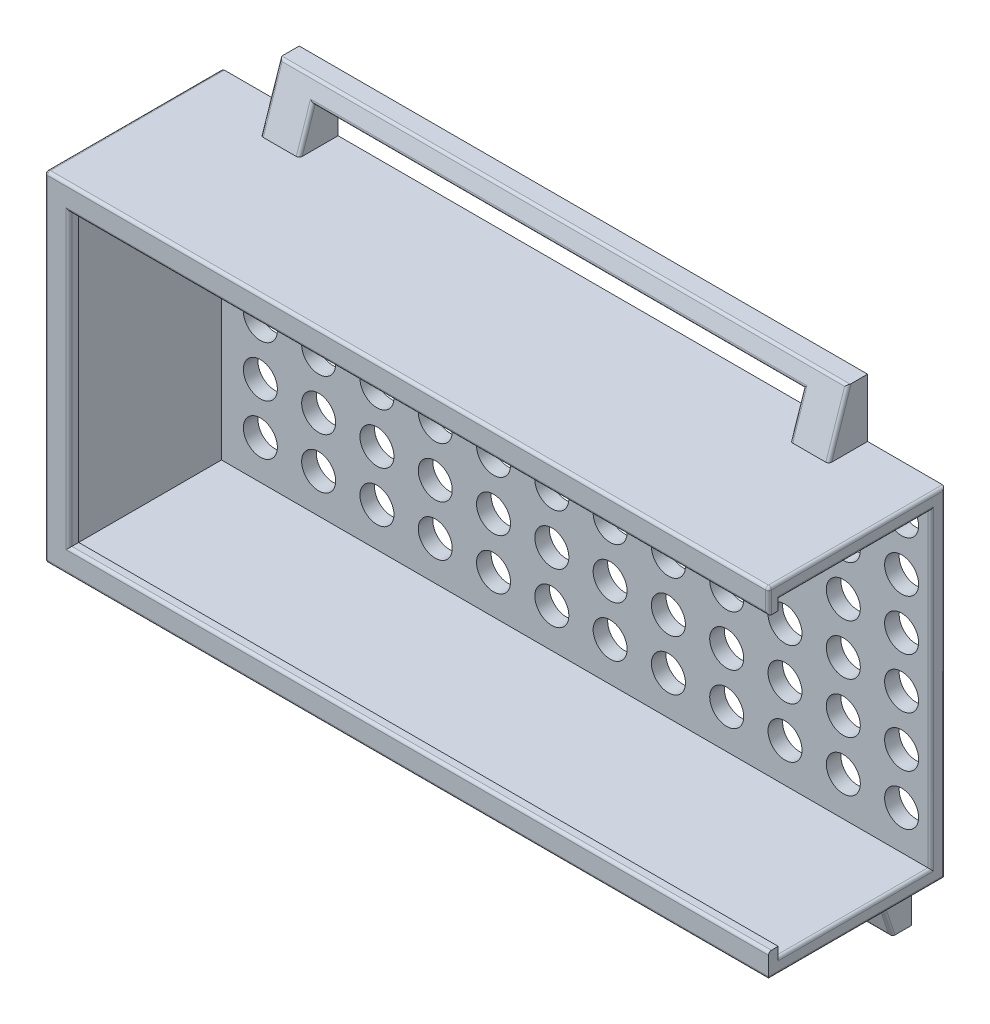
from build123d import *

# Parameters (mm, degrees)
SKETCH_1_W          = 74.5
SKETCH_1_H          = 34.9
SKETCH_1_W_2        = 71.5
SKETCH_1_H_2        = 31.9
EXTRUDE_1_DEPTH     = 18.2
SKETCH_2_W          = 71.5
SKETCH_2_H          = 31.9
EXTRUDE_2_DEPTH     = 1.5
SKETCH_3_W          = 16.7
SKETCH_3_H          = 31.9
CUT_EXTRUDE_1_DEPTH = 83.315247676
EXTRUDE_3_DEPTH     = 1
SKETCH_5_W          = 4
SKETCH_5_H          = 4
EXTRUDE_5_DEPTH     = 6
EXTRUDE_6_REACH     = 78.091
SKETCH_15_W         = 4
SKETCH_15_H         = 2
CUT_EXTRUDE_2_DEPTH = 80.409382317
SKETCH_17_W         = 4
SKETCH_17_H         = 4
EXTRUDE_7_DEPTH     = 6
EXTRUDE_8_REACH     = 81.829
SKETCH_18_W         = 4
SKETCH_18_H         = 2
CUT_EXTRUDE_3_DEPTH = 84.214181484
FILLET_1_R          = 0.3
SKETCH_20_R         = 1.75
CUT_EXTRUDE_4_DEPTH = 85.618260441


with BuildPart() as part:
    # 草图1 → 凸台-拉伸1 (new body)
    with BuildSketch(Plane.XY):
        with Locations((35.75, 15.95)):
            Rectangle(SKETCH_1_W, SKETCH_1_H)
        with Locations((35.75, 15.95)):
            Rectangle(SKETCH_1_W_2, SKETCH_1_H_2, mode=Mode.SUBTRACT)
    extrude(amount=EXTRUDE_1_DEPTH)

    # 草图2 → 凸台-拉伸2 (add)
    with BuildSketch(Plane(origin=(0, 0, 0), x_dir=(-1, 0, 0), z_dir=(0, 0, -1))):
        with Locations((-35.75, 15.95)):
            Rectangle(SKETCH_2_W, SKETCH_2_H)
    extrude(amount=-EXTRUDE_2_DEPTH)

    # 草图3 → 切除-拉伸1 (cut, through all)
    with BuildSketch(Plane.ZY.offset(-71.5)):
        with Locations((9.85, 15.95)):
            Rectangle(SKETCH_3_W, SKETCH_3_H)
    extrude(amount=-CUT_EXTRUDE_1_DEPTH, mode=Mode.SUBTRACT)

    # 草图4 → 凸台-拉伸3 (add)
    with BuildSketch(Plane.XY.offset(18.2)):
        Polygon((1, 1), (73, 1), (73, 0), (0, 0), (0, 31.9), (73, 31.9), (73, 30.9), (1, 30.9), align=None)
    extrude(amount=-EXTRUDE_3_DEPTH)

    # 草图5 → 凸台-拉伸5 (add)
    with BuildSketch(Plane(origin=(0, 33.4, 0), x_dir=(1, 0, 0), z_dir=(0, 1, 0))):
        with Locations((8.5, -2)):
            Rectangle(SKETCH_5_W, SKETCH_5_H)
        with Locations((63, -2)):
            Rectangle(SKETCH_5_W, SKETCH_5_H)
    extrude(amount=EXTRUDE_5_DEPTH)

    # 草图15 → 凸台-拉伸6 (add, up to next)
    with BuildSketch(Plane.ZY.offset(-61), mode=Mode.PRIVATE) as extrude_6_sk1:
        with Locations((2, 38.4)):
            Rectangle(SKETCH_15_W, SKETCH_15_H)
    extrude_6_tool1 = extrude(extrude_6_sk1.sketch, amount=EXTRUDE_6_REACH, mode=Mode.PRIVATE) - part.part
    add(extrude_6_tool1.solids().sort_by_distance((61, 38.4, 2))[0])

    # 草图16 → 切除-拉伸2 (cut, through all)
    with BuildSketch(Plane(origin=(65, 0, 0), x_dir=(0, 0, -1), z_dir=(1, 0, 0))):
        Polygon((-4, 33.4), (-2, 39.4), (-4, 39.4), align=None)
    extrude(amount=-CUT_EXTRUDE_2_DEPTH, mode=Mode.SUBTRACT)

    # 草图17 → 凸台-拉伸7 (add)
    with BuildSketch(Plane.XZ.offset(1.5)):
        with Locations((4, 2)):
            Rectangle(SKETCH_17_W, SKETCH_17_H)
        with Locations((67.5, 2)):
            Rectangle(SKETCH_17_W, SKETCH_17_H)
    extrude(amount=EXTRUDE_7_DEPTH)

    # 草图18 → 凸台-拉伸8 (add, up to next)
    with BuildSketch(Plane.ZY.offset(-65.5), mode=Mode.PRIVATE) as extrude_8_sk1:
        with Locations((2, -6.5)):
            Rectangle(SKETCH_18_W, SKETCH_18_H)
    extrude_8_tool1 = extrude(extrude_8_sk1.sketch, amount=EXTRUDE_8_REACH, mode=Mode.PRIVATE) - part.part
    add(extrude_8_tool1.solids().sort_by_distance((65.5, -6.5, 2))[0])

    # 草图19 → 切除-拉伸3 (cut, through all)
    with BuildSketch(Plane.ZY.offset(-2)):
        Polygon((4, -1.5), (2, -7.5), (4, -7.5), align=None)
    extrude(amount=-CUT_EXTRUDE_3_DEPTH, mode=Mode.SUBTRACT)

    # 圆角1
    fillet_1_edges = [part.edges().sort_by_distance(p)[0] for p in [
        (-1.5, 33.4, 9.1),
        (-1.5, 15.95, 18.2),
        (-1.5, -1.5, 9.1),
        (-1.5, 15.95, 0),
        (73, 31.9, 9.35),
        (73, 15.95, 1.5),
        (73, 0, 9.35),
        (73, -1.5, 9.1),
        (1, 15.95, 18.2),
        (37, 1, 18.2),
        (35.75, -1.5, 18.2),
        (73, 15.95, 0),
        (73, 32.15, 18.2),
        (37, 30.9, 18.2),
        (73, 33.4, 9.1),
        (35.75, 33.4, 18.2),
        (10.5, 35.4, 3.333333333),
        (35.75, 37.4, 2.666666667),
        (61, 35.4, 3.333333333),
        (6, -3.5, 3.333333333),
        (35.75, -5.5, 2.666666667),
        (65.5, -3.5, 3.333333333),
        (69.5, -4.5, 3),
        (35.75, -7.5, 2),
        (2, -4.5, 3),
        (65, 36.4, 3),
        (35.75, 39.4, 2),
        (6.5, 36.4, 3),
    ]]
    fillet(fillet_1_edges, radius=FILLET_1_R)

    # 草图20 → 切除-拉伸4 (cut, through all)
    with BuildSketch(Plane.XY.offset(1.5)):
        with Locations((4, 4)):
            Circle(SKETCH_20_R)
        with Locations((10, 4)):
            Circle(SKETCH_20_R)
        with Locations((16, 4)):
            Circle(SKETCH_20_R)
        with Locations((22, 4)):
            Circle(SKETCH_20_R)
        with Locations((28, 4)):
            Circle(SKETCH_20_R)
        with Locations((34, 4)):
            Circle(SKETCH_20_R)
        with Locations((40, 4)):
            Circle(SKETCH_20_R)
        with Locations((46, 4)):
            Circle(SKETCH_20_R)
        with Locations((52, 4)):
            Circle(SKETCH_20_R)
        with Locations((58, 4)):
            Circle(SKETCH_20_R)
        with Locations((64, 4)):
            Circle(SKETCH_20_R)
        with Locations((70, 4)):
            Circle(SKETCH_20_R)
        with Locations((4, 9.2)):
            Circle(SKETCH_20_R)
        with Locations((4, 14.4)):
            Circle(SKETCH_20_R)
        with Locations((4, 19.6)):
            Circle(SKETCH_20_R)
        with Locations((4, 24.8)):
            Circle(SKETCH_20_R)
        with Locations((4, 30)):
            Circle(SKETCH_20_R)
        with Locations((10, 30)):
            Circle(SKETCH_20_R)
        with Locations((10, 24.8)):
            Circle(SKETCH_20_R)
        with Locations((10, 19.6)):
            Circle(SKETCH_20_R)
        with Locations((10, 14.4)):
            Circle(SKETCH_20_R)
        with Locations((10, 9.2)):
            Circle(SKETCH_20_R)
        with Locations((16, 30)):
            Circle(SKETCH_20_R)
        with Locations((16, 24.8)):
            Circle(SKETCH_20_R)
        with Locations((16, 19.6)):
            Circle(SKETCH_20_R)
        with Locations((16, 14.4)):
            Circle(SKETCH_20_R)
        with Locations((16, 9.2)):
            Circle(SKETCH_20_R)
        with Locations((22, 30)):
            Circle(SKETCH_20_R)
        with Locations((22, 24.8)):
            Circle(SKETCH_20_R)
        with Locations((22, 19.6)):
            Circle(SKETCH_20_R)
        with Locations((22, 14.4)):
            Circle(SKETCH_20_R)
        with Locations((22, 9.2)):
            Circle(SKETCH_20_R)
        with Locations((28, 30)):
            Circle(SKETCH_20_R)
        with Locations((28, 24.8)):
            Circle(SKETCH_20_R)
        with Locations((28, 19.6)):
            Circle(SKETCH_20_R)
        with Locations((28, 14.4)):
            Circle(SKETCH_20_R)
        with Locations((28, 9.2)):
            Circle(SKETCH_20_R)
        with Locations((34, 30)):
            Circle(SKETCH_20_R)
        with Locations((34, 24.8)):
            Circle(SKETCH_20_R)
        with Locations((34, 19.6)):
            Circle(SKETCH_20_R)
        with Locations((34, 14.4)):
            Circle(SKETCH_20_R)
        with Locations((34, 9.2)):
            Circle(SKETCH_20_R)
        with Locations((40, 30)):
            Circle(SKETCH_20_R)
        with Locations((40, 24.8)):
            Circle(SKETCH_20_R)
        with Locations((40, 19.6)):
            Circle(SKETCH_20_R)
        with Locations((40, 14.4)):
            Circle(SKETCH_20_R)
        with Locations((40, 9.2)):
            Circle(SKETCH_20_R)
        with Locations((46, 30)):
            Circle(SKETCH_20_R)
        with Locations((46, 24.8)):
            Circle(SKETCH_20_R)
        with Locations((46, 19.6)):
            Circle(SKETCH_20_R)
        with Locations((46, 14.4)):
            Circle(SKETCH_20_R)
        with Locations((46, 9.2)):
            Circle(SKETCH_20_R)
        with Locations((52, 30)):
            Circle(SKETCH_20_R)
        with Locations((52, 24.8)):
            Circle(SKETCH_20_R)
        with Locations((52, 19.6)):
            Circle(SKETCH_20_R)
        with Locations((52, 14.4)):
            Circle(SKETCH_20_R)
        with Locations((52, 9.2)):
            Circle(SKETCH_20_R)
        with Locations((58, 30)):
            Circle(SKETCH_20_R)
        with Locations((58, 24.8)):
            Circle(SKETCH_20_R)
        with Locations((58, 19.6)):
            Circle(SKETCH_20_R)
        with Locations((58, 14.4)):
            Circle(SKETCH_20_R)
        with Locations((58, 9.2)):
            Circle(SKETCH_20_R)
        with Locations((64, 30)):
            Circle(SKETCH_20_R)
        with Locations((64, 24.8)):
            Circle(SKETCH_20_R)
        with Locations((64, 19.6)):
            Circle(SKETCH_20_R)
        with Locations((64, 14.4)):
            Circle(SKETCH_20_R)
        with Locations((64, 9.2)):
            Circle(SKETCH_20_R)
        with Locations((70, 30)):
            Circle(SKETCH_20_R)
        with Locations((70, 24.8)):
            Circle(SKETCH_20_R)
        with Locations((70, 19.6)):
            Circle(SKETCH_20_R)
        with Locations((70, 14.4)):
            Circle(SKETCH_20_R)
        with Locations((70, 9.2)):
            Circle(SKETCH_20_R)
    extrude(amount=-CUT_EXTRUDE_4_DEPTH, mode=Mode.SUBTRACT)


solid = part.part
